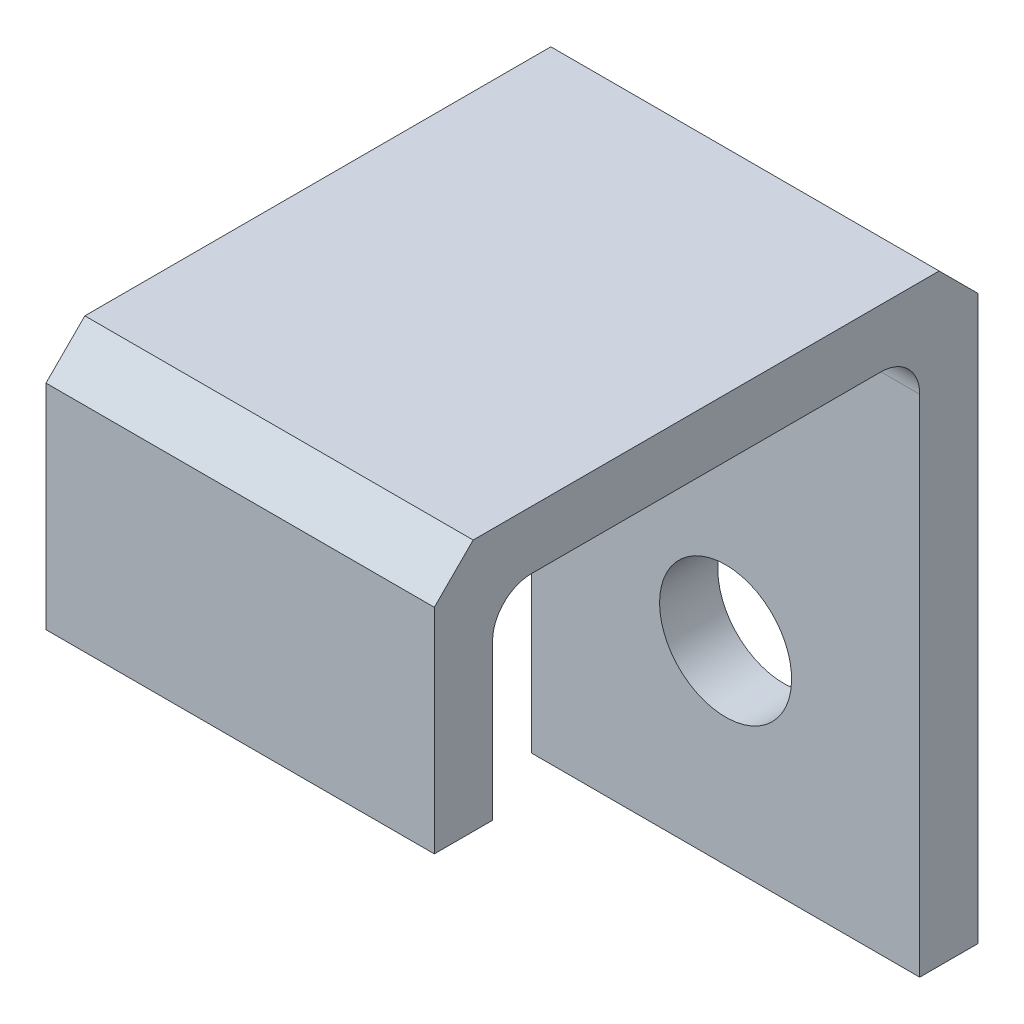
from build123d import *

# Parameters (mm, degrees)
BOSS_EXTRUDE1_DEPTH = 10
SKETCH2_R           = 1.7
CUT_EXTRUDE1_DEPTH  = 10


with BuildPart() as part:
    # Sketch1 → Boss-Extrude1 (new body)
    with BuildSketch(Plane(origin=(0, 0, 0), x_dir=(0, 0, -1), z_dir=(1, 0, 0))):
        with BuildLine():
            Line((-2.1875, 6.5), (-3.1875, 5.5))
            Line((-3.1875, 5.5), (-3.1875, 5.296875))
            Line((-3.1875, 5.296875), (-3.1875, 0))
            Line((-3.1875, 0), (-1.6875, 0))
            Line((-1.6875, 0), (-1.6875, 4))
            ThreePointArc((-1.6875, 4), (-1.394606781, 4.707106781), (-0.6875, 5))
            Line((-0.6875, 5), (8.3125, 5))
            ThreePointArc((8.3125, 5), (9.019606781, 4.707106781), (9.3125, 4))
            Line((9.3125, 4), (9.3125, -9))
            Line((9.3125, -9), (10.8125, -9))
            Line((10.8125, -9), (10.8125, 5.5))
            Line((10.8125, 5.5), (9.8125, 6.5))
            Line((9.8125, 6.5), (4.875, 6.5))
            Line((4.875, 6.5), (-2.1875, 6.5))
        make_face()
    extrude(amount=BOSS_EXTRUDE1_DEPTH)

    # Sketch2 → Cut-Extrude1 (cut)
    with BuildSketch(Plane(origin=(0, 0, -10.8125), x_dir=(-1, 0, 0), z_dir=(0, 0, -1))):
        with Locations((-5, -4)):
            Circle(SKETCH2_R)
    extrude(amount=-CUT_EXTRUDE1_DEPTH, mode=Mode.SUBTRACT)


solid = part.part
